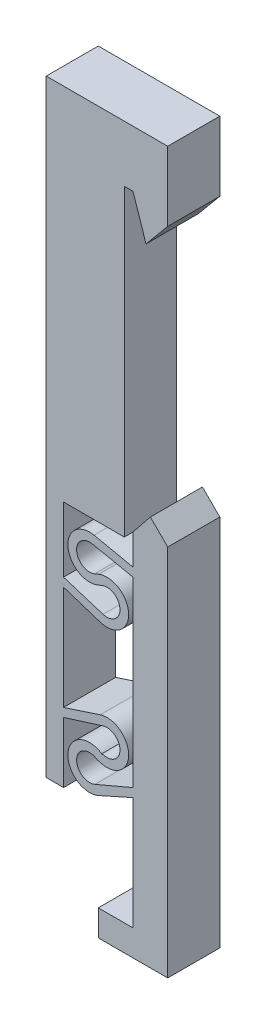
from build123d import *

# Parameters (mm, degrees)
BOSS_EXTRUDE4_DEPTH = 6


with BuildPart() as part:
    # Sketch5 → Boss-Extrude4 (new body)
    with BuildSketch(Plane.XY):
        with BuildLine():
            Line((0, 31.5), (14, 31.5))
            Line((14, 31.5), (14, 23.5))
            Line((14, 23.5), (11.5, 20.5))
            Line((11.5, 20.5), (10, 25))
            Line((10, 25), (9, 25))
            Line((9, 25), (9, -10))
            Line((9, -10), (2, -10))
            Line((2, -10), (2, -17.5))
            Line((2, -17.5), (6.55, -18.930908802))
            ThreePointArc((6.55, -18.930908802), (8.498478182, -17.432449005), (6.423076923, -16.115384615))
            Line((6.423076923, -16.115384615), (5.961538462, -16.307692308))
            ThreePointArc((5.961538462, -16.307692308), (2.51090022, -14.2332001), (5.516159308, -11.55386436))
            Line((5.516159308, -11.55386436), (10, -12.5))
            Line((10, -12.5), (10, -9))
            Line((10, -9), (12, -6.5))
            Line((12, -6.5), (14, -8.5))
            Line((14, -8.5), (14, -51.5))
            Line((14, -51.5), (6, -51.5))
            Line((6, -51.5), (6, -48.5))
            Line((6, -48.5), (10, -48.5))
            Line((10, -48.5), (10, -35.5))
            Line((10, -35.5), (6.021836686, -37.28163314))
            ThreePointArc((6.021836686, -37.28163314), (2.518102723, -34.699690318), (6.536534963, -33.027929944))
            Line((6.536534963, -33.027929944), (6.436915421, -32.8903006))
            ThreePointArc((6.436915421, -32.8903006), (8.498796421, -31.560077342), (6.55, -30.069091198))
            Line((6.55, -30.069091198), (2, -31.5))
            Line((2, -31.5), (2, -38.5))
            Line((2, -38.5), (0, -38.5))
            Line((0, -38.5), (0, 31.5))
        make_face()
        with BuildLine():
            Line((10, -13.5), (10, -34.5))
            Line((10, -34.5), (5.613102012, -36.368979884))
            ThreePointArc((5.613102012, -36.368979884), (3.510861634, -34.819814191), (5.921920978, -33.816757966))
            Line((5.921920978, -33.816757966), (6.061525702, -33.817167666))
            ThreePointArc((6.061525702, -33.817167666), (9.498478082, -31.587219699), (6.225393962, -29.123030188))
            Line((6.225393962, -29.123030188), (2, -30.5))
            Line((2, -30.5), (2, -18.5))
            Line((2, -18.5), (6.225393962, -19.876969812))
            ThreePointArc((6.225393962, -19.876969812), (9.498012054, -17.400321638), (6.038461538, -15.192307692))
            Line((6.038461538, -15.192307692), (5.576923077, -15.384615385))
            ThreePointArc((5.576923077, -15.384615385), (3.50685843, -14.143276833), (5.303094113, -12.530941132))
            Line((5.303094113, -12.530941132), (10, -13.5))
        make_face(mode=Mode.SUBTRACT)
    extrude(amount=BOSS_EXTRUDE4_DEPTH)


solid = part.part
